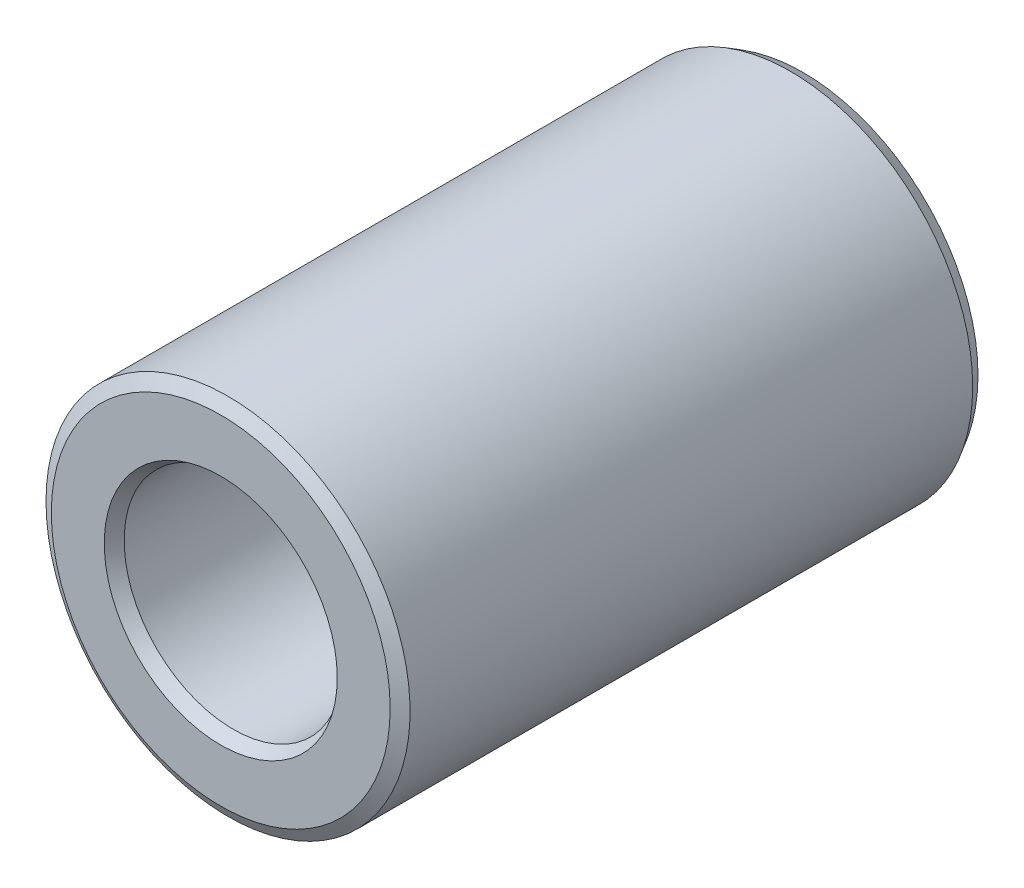
from build123d import *
from OCP.BRepFilletAPI import BRepFilletAPI_MakeChamfer

# Parameters (mm, degrees)
SKETCH1_R           = 2.5
SKETCH1_R_2         = 1.5
BOSS_EXTRUDE1_DEPTH = 4
CHAMFER1_SIZE       = 0.1
CHAMFER1_SIZE2      = 0.173205081


with BuildPart() as part:
    # Sketch1 → Boss-Extrude1 (new, symmetric)
    with BuildSketch(Plane.XY):
        Circle(SKETCH1_R)
        Circle(SKETCH1_R_2, mode=Mode.SUBTRACT)
    extrude(amount=BOSS_EXTRUDE1_DEPTH, both=True)

    # Chamfer1: one chamfer whose edges measure the first distance from different faces: ONE call of the kernel's chamfer builder (chamfer() names one face for all edges)
    chamfer1_edges_1 = [part.edges().sort_by_distance(p)[0] for p in [
        (-2.5, 0, -4),
    ]]
    chamfer1_side_1 = [part.faces().sort_by_distance(p)[0] for p in [
        (-2.429289322, 0, -4),
    ]]
    chamfer1_edges_2 = [part.edges().sort_by_distance(p)[0] for p in [
        (-2.5, 0, 4),
    ]]
    chamfer1_side_2 = [part.faces().sort_by_distance(p)[0] for p in [
        (-2.5, 0, 0),
    ]]
    chamfer1_edges_3 = [part.edges().sort_by_distance(p)[0] for p in [
        (-1.5, 0, -4),
    ]]
    chamfer1_side_3 = [part.faces().sort_by_distance(p)[0] for p in [
        (-1.5, 0, 0),
    ]]
    chamfer1_edges_4 = [part.edges().sort_by_distance(p)[0] for p in [
        (-1.5, 0, 4),
    ]]
    chamfer1_side_4 = [part.faces().sort_by_distance(p)[0] for p in [
        (-2.429289322, 0, 4),
    ]]
    chamfer1 = BRepFilletAPI_MakeChamfer(part.part.solid().wrapped)
    for e in chamfer1_edges_1:
        chamfer1.Add(CHAMFER1_SIZE, CHAMFER1_SIZE2, e.wrapped, chamfer1_side_1[0].wrapped)  # the first distance lies on this face
    for e in chamfer1_edges_2:
        chamfer1.Add(CHAMFER1_SIZE, CHAMFER1_SIZE2, e.wrapped, chamfer1_side_2[0].wrapped)  # the first distance lies on this face
    for e in chamfer1_edges_3:
        chamfer1.Add(CHAMFER1_SIZE, CHAMFER1_SIZE2, e.wrapped, chamfer1_side_3[0].wrapped)  # the first distance lies on this face
    for e in chamfer1_edges_4:
        chamfer1.Add(CHAMFER1_SIZE, CHAMFER1_SIZE2, e.wrapped, chamfer1_side_4[0].wrapped)  # the first distance lies on this face
    add(Compound.cast(chamfer1.Shape()), mode=Mode.REPLACE)


solid = part.part
